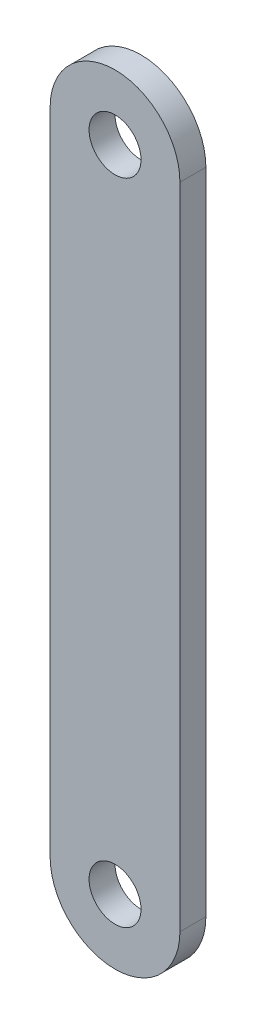
from build123d import *

# Parameters (mm, degrees)
CROQUIS1_R              = 10
SALIENTE_EXTRUIR1_DEPTH = 10


with BuildPart() as part:
    # Croquis1 → Saliente-Extruir1 (new body)
    with BuildSketch(Plane.XY):
        with BuildLine():
            Line((50, 0), (50, 250))
            ThreePointArc((50, 250), (25, 275), (0, 250))
            Line((0, 250), (0, 0))
            ThreePointArc((0, 0), (25, -25), (50, 0))
        make_face()
        with Locations((25, 250)):
            Circle(CROQUIS1_R, mode=Mode.SUBTRACT)
        with Locations((25, 0)):
            Circle(CROQUIS1_R, mode=Mode.SUBTRACT)
    extrude(amount=SALIENTE_EXTRUIR1_DEPTH)


solid = part.part
